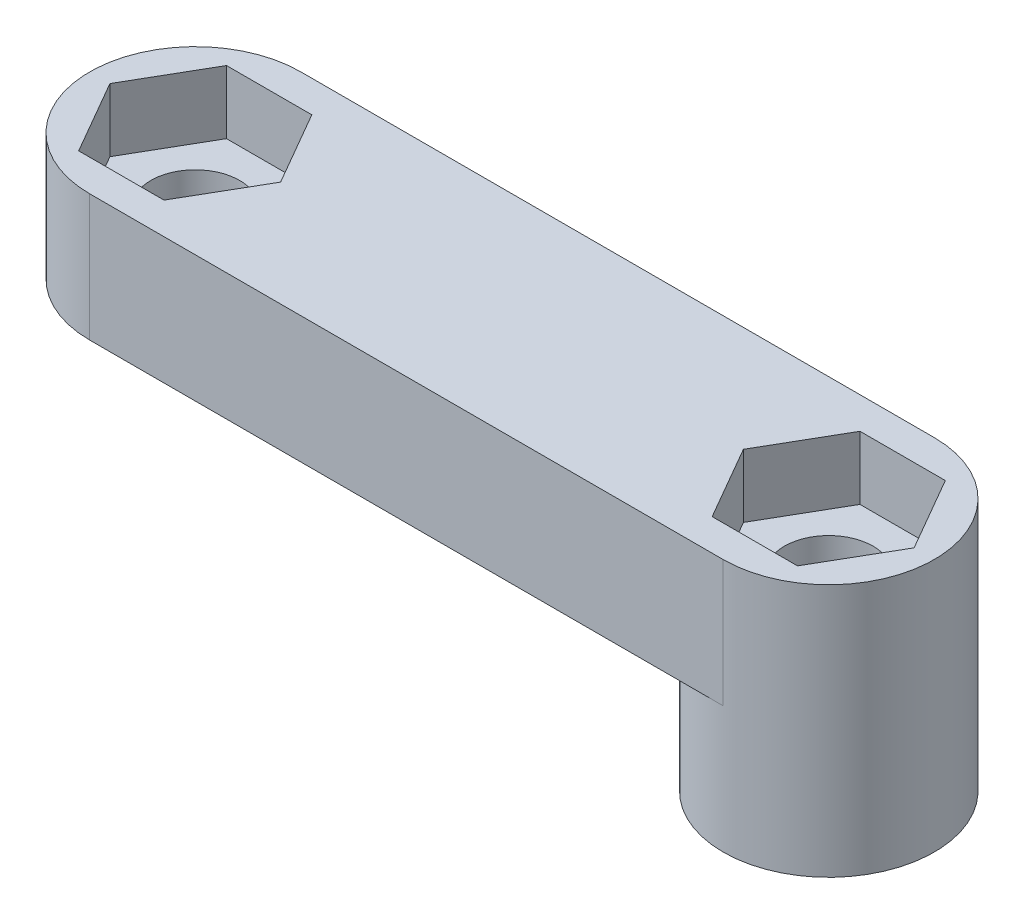
from build123d import *

# Parameters (mm, degrees)
SKETCH1_R           = 2.1
BOSS_EXTRUDE1_DEPTH = 3
CUT_EXTRUDE1_DEPTH  = 3
SKETCH3_R           = 5
SKETCH3_R_2         = 2.1
BOSS_EXTRUDE2_DEPTH = 6


with BuildPart() as part:
    # Sketch1 → Boss-Extrude1 (new, symmetric)
    with BuildSketch(Plane(origin=(0, 0, 0), x_dir=(1, 0, 0), z_dir=(0, 1, 0))):
        with BuildLine():
            Line((-15, 5), (15, 5))
            ThreePointArc((15, 5), (20, 0), (15, -5))
            Line((15, -5), (-15, -5))
            ThreePointArc((-15, -5), (-20, 0), (-15, 5))
        make_face()
        with Locations(Location((15, 0, 0), (0, 0, 270))):
            Circle(SKETCH1_R, mode=Mode.SUBTRACT)
        with Locations(Location((-15, 0, 0), (0, 0, 270))):
            Circle(SKETCH1_R, mode=Mode.SUBTRACT)
    extrude(amount=BOSS_EXTRUDE1_DEPTH, both=True)

    # Sketch2 → Cut-Extrude1 (cut)
    with BuildSketch(Plane(origin=(0, 3, 0), x_dir=(1, 0, 0), z_dir=(0, 1, 0))):
        Polygon((-10.958548116, 0), (-12.979274058, 3.5), (-17.020725942, 3.5), (-19.041451884, 0), (-17.020725942, -3.5), (-12.979274058, -3.5), align=None)
        Polygon((10.958548116, 0), (12.979274058, -3.5), (17.020725942, -3.5), (19.041451884, 0), (17.020725942, 3.5), (12.979274058, 3.5), align=None)
    extrude(amount=-CUT_EXTRUDE1_DEPTH, mode=Mode.SUBTRACT)

    # Sketch3 → Boss-Extrude2 (add)
    with BuildSketch(Plane.XZ.offset(3)):
        with Locations(Location((15, 0, 0), (0, 0, 270))):
            Circle(SKETCH3_R)
        with Locations(Location((15, 0, 0), (0, 0, 270))):
            Circle(SKETCH3_R_2, mode=Mode.SUBTRACT)
    extrude(amount=BOSS_EXTRUDE2_DEPTH)


solid = part.part
